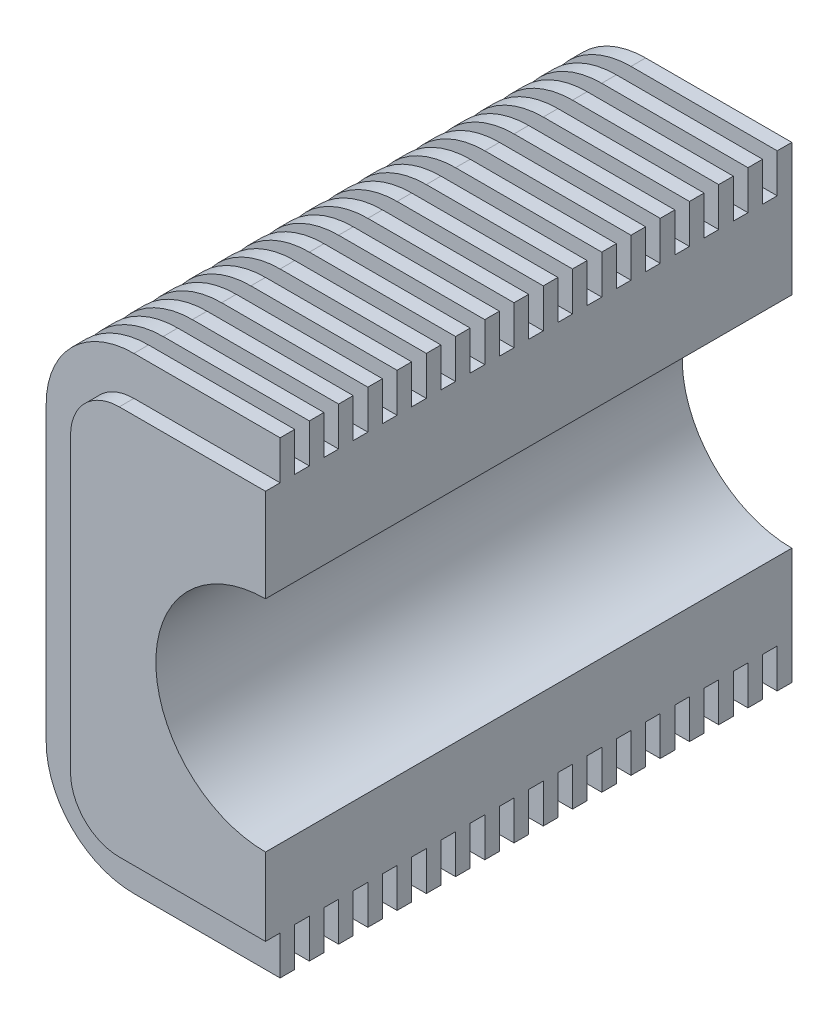
from build123d import *

# Parameters (mm, degrees)
DODANIE_WYCI_GNI_CIE1_DEPTH = 108
SZKIC2_R                    = 22.5
WYTNIJ_WYCI_GNI_CIE1_DEPTH  = 138.437258413
DODANIE_WYCI_GNI_CIE2_DEPTH = 3
SZYK_LINIOWY5_COUNT         = 18
SZYK_LINIOWY5_PITCH         = 6


with BuildPart() as part:
    # Szkic1 → Dodanie-wyciągnięcie1 (new body)
    with BuildSketch(Plane.XY):
        with BuildLine():
            Line((0, 75), (-30, 75))
            ThreePointArc((-30, 75), (-37.071067812, 72.071067812), (-40, 65))
            Line((-40, 65), (-40, 5))
            ThreePointArc((-40, 5), (-37.071067812, -2.071067812), (-30, -5))
            Line((-30, -5), (0, -5))
            Line((0, -5), (0, 75))
        make_face()
    extrude(amount=DODANIE_WYCI_GNI_CIE1_DEPTH)

    # Szkic2 → Wytnij-wyciągnięcie1 (cut, through all)
    with BuildSketch(Plane.XY.offset(108)):
        with Locations((0, 33.385787432)):
            Circle(SZKIC2_R)
    extrude(amount=-WYTNIJ_WYCI_GNI_CIE1_DEPTH, mode=Mode.SUBTRACT)

    # Szkic3 → Dodanie-wyciągnięcie2 (add)
    with BuildSketch(Plane(origin=(0, 0, 0), x_dir=(-1, 0, 0), z_dir=(0, 0, -1))):
        with BuildLine():
            Line((0, 75), (30, 75))
            ThreePointArc((30, 75), (37.071067812, 72.071067812), (40, 65))
            Line((40, 65), (40, 5))
            ThreePointArc((40, 5), (37.071067812, -2.071067812), (30, -5))
            Line((30, -5), (0, -5))
            Line((0, -5), (0, -13))
            Line((0, -13), (30, -13))
            ThreePointArc((30, -13), (42.727922061, -7.727922061), (48, 5))
            Line((48, 5), (48, 65))
            ThreePointArc((48, 65), (42.727922061, 77.727922061), (30, 83))
            Line((30, 83), (0, 83))
            Line((0, 83), (0, 75))
        make_face()
    dodanie_wyci_gni_cie2 = extrude(amount=-DODANIE_WYCI_GNI_CIE2_DEPTH)

    # Szyk liniowy5: Dodanie-wyciągnięcie2 ×18
    with Locations(*[(0, 0, i * SZYK_LINIOWY5_PITCH) for i in range(1, SZYK_LINIOWY5_COUNT)]):
        add(dodanie_wyci_gni_cie2)


solid = part.part
